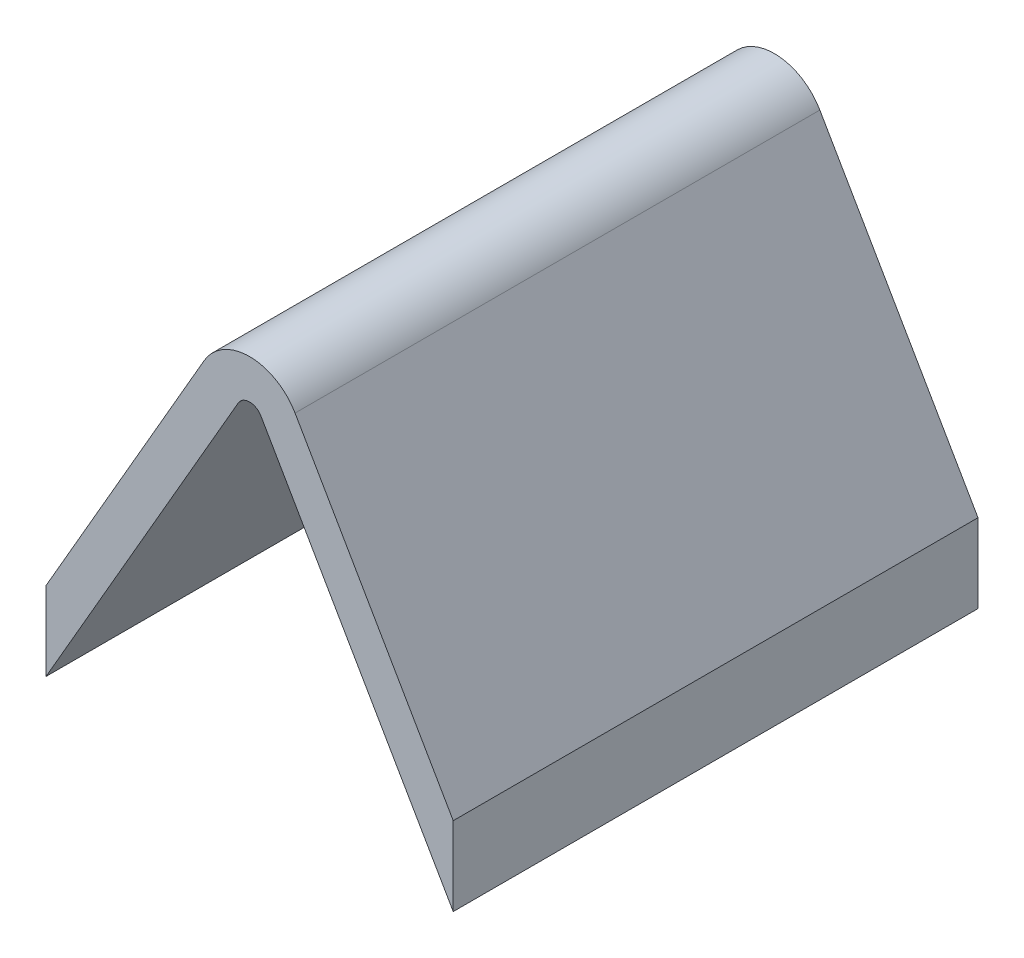
from build123d import *

# Parameters (mm, degrees)
BOSS_EXTRUDE1_DEPTH = 200


with BuildPart() as part:
    # Sketch1 → Boss-Extrude1 (new body)
    with BuildSketch(Plane.XY):
        with BuildLine():
            Line((-77.598076211, 1.5), (-4.330127019, 128.403810568))
            ThreePointArc((-4.330127019, 128.403810568), (0, 130.903810568), (4.330127019, 128.403810568))
            Line((4.330127019, 128.403810568), (77.598076211, 1.5))
            Line((77.598076211, 1.5), (77.598076211, 31.5))
            Line((77.598076211, 31.5), (17.320508076, 135.903810568))
            ThreePointArc((17.320508076, 135.903810568), (0, 145.903810568), (-17.320508076, 135.903810568))
            Line((-17.320508076, 135.903810568), (-77.598076211, 31.5))
            Line((-77.598076211, 31.5), (-77.598076211, 1.5))
        make_face()
    extrude(amount=BOSS_EXTRUDE1_DEPTH)


solid = part.part
